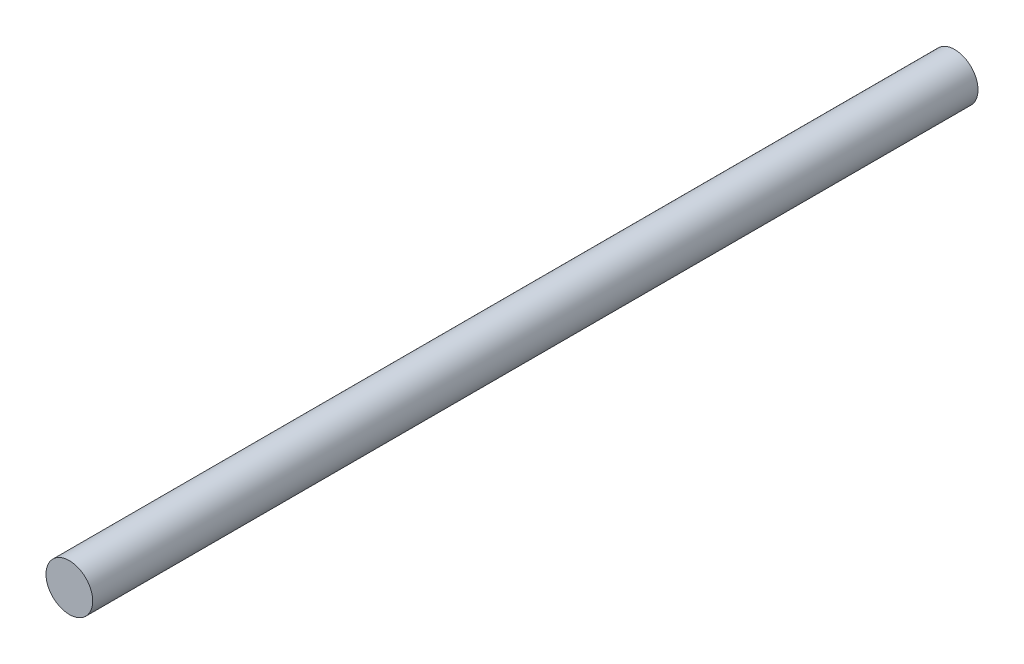
from build123d import *

# Parameters (mm, degrees)
SKETCH1_R           = 2.5
BOSS_EXTRUDE1_DEPTH = 304.8
CUT_EXTRUDE1_START  = -210
SKETCH2_R           = 2.5
CUT_EXTRUDE1_DEPTH  = 210


with BuildPart() as part:
    # Sketch1 → Boss-Extrude1 (new body)
    with BuildSketch(Plane.XY):
        with Locations(Location((0, 0, 0), (0, 0, 180))):
            Circle(SKETCH1_R)
    extrude(amount=BOSS_EXTRUDE1_DEPTH)

    # Sketch2 → Cut-Extrude1 (cut)
    with BuildSketch(Plane.XY.offset(304.8).offset(CUT_EXTRUDE1_START)):
        with Locations(Location((0, 0, 0), (0, 0, 180))):
            Circle(SKETCH2_R)
    extrude(amount=CUT_EXTRUDE1_DEPTH, mode=Mode.SUBTRACT)


solid = part.part
